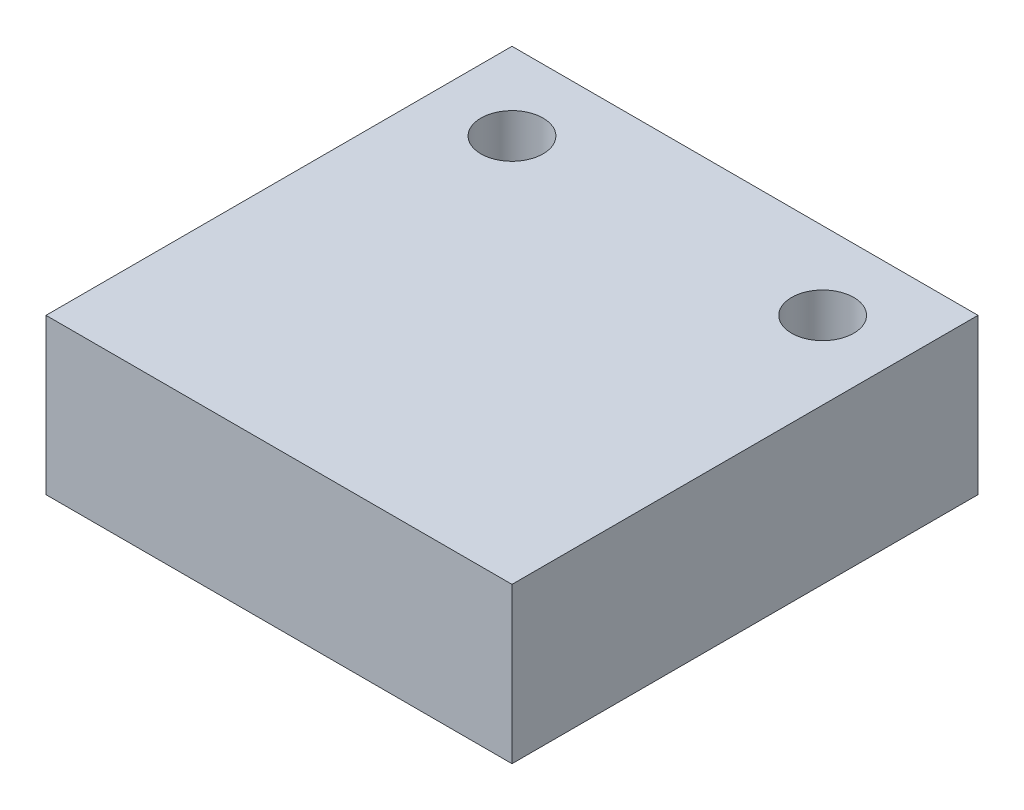
from build123d import *

# Parameters (mm, degrees)
SKETCH1_W           = 150
SKETCH1_H           = 150
BOSS_EXTRUDE1_DEPTH = 50
SKETCH2_R           = 10
CUT_EXTRUDE1_DEPTH  = 50


with BuildPart() as part:
    # Sketch1 → Boss-Extrude1 (new body)
    with BuildSketch(Plane(origin=(0, 0, 0), x_dir=(1, 0, 0), z_dir=(0, 1, 0))):
        Rectangle(SKETCH1_W, SKETCH1_H)
    extrude(amount=BOSS_EXTRUDE1_DEPTH)

    # Sketch2 → Cut-Extrude1 (cut)
    with BuildSketch(Plane(origin=(0, 50, 0), x_dir=(1, 0, 0), z_dir=(0, 1, 0))):
        with Locations((-50, 50)):
            Circle(SKETCH2_R)
        with Locations((50, 50)):
            Circle(SKETCH2_R)
    extrude(amount=-CUT_EXTRUDE1_DEPTH, mode=Mode.SUBTRACT)


solid = part.part
